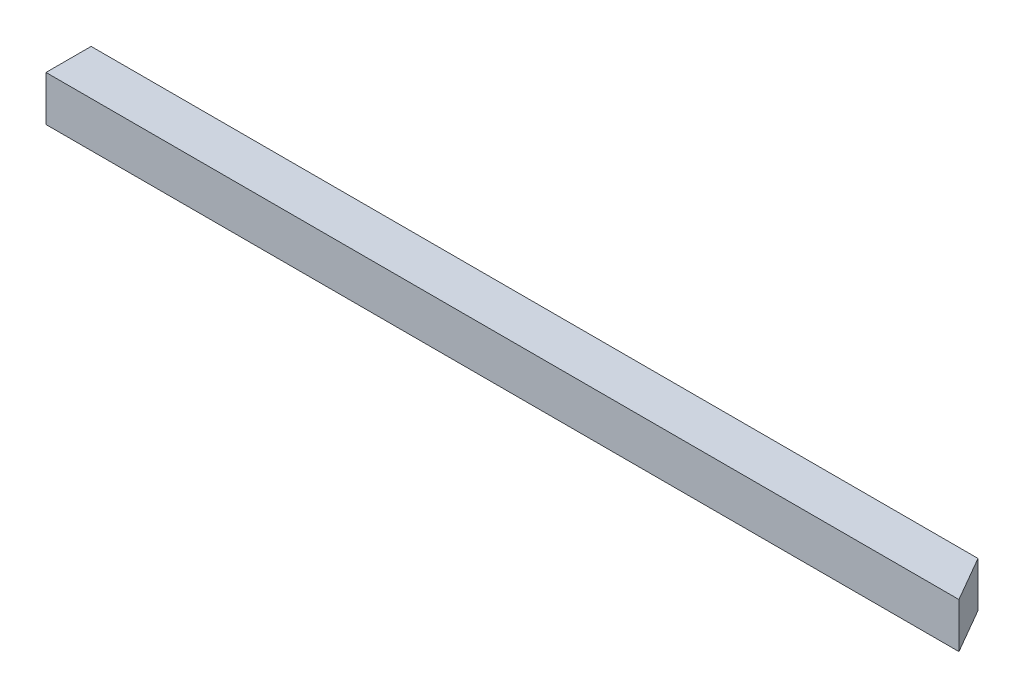
from build123d import *

# Parameters (mm, degrees)
EXTRUDE_1_DEPTH = 20


with BuildPart() as part:
    # 草图1 → 凸台-拉伸1 (new body)
    with BuildSketch(Plane(origin=(0, 0, 0), x_dir=(1, 0, 0), z_dir=(0, 1, 0))):
        Polygon((480, -563.730669589), (503.094010768, -563.730669589), (514.641016151, -583.730669589), (480, -583.730669589), (110, -583.730669589), (110, -563.730669589), align=None)
    extrude(amount=EXTRUDE_1_DEPTH)


solid = part.part
